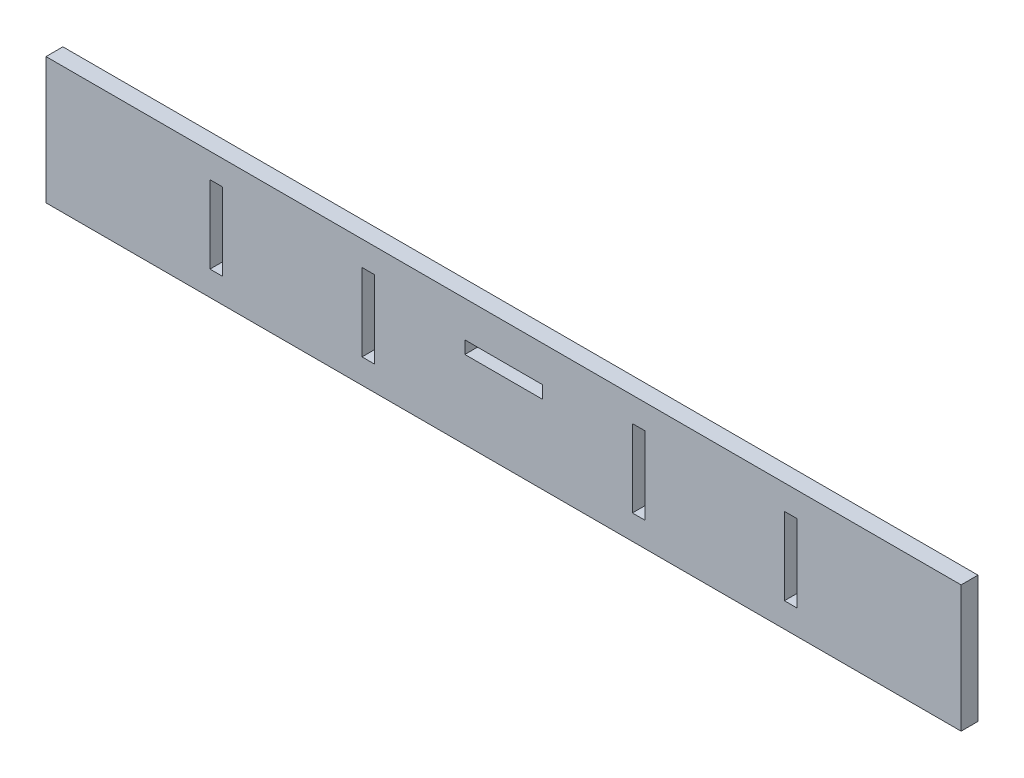
from build123d import *

# Parameters (mm, degrees)
SKETCH2_W           = 130
SKETCH2_H           = 18
BOSS_EXTRUDE1_DEPTH = 2.4
SKETCH3_W           = 1.8
SKETCH3_H           = 11
SKETCH3_H_2         = 5.5
CUT_EXTRUDE1_DEPTH  = 11


with BuildPart() as part:
    # Sketch2 → Boss-Extrude1 (new body)
    with BuildSketch(Plane.XY):
        Rectangle(SKETCH2_W, SKETCH2_H)
    extrude(amount=BOSS_EXTRUDE1_DEPTH)

    # Sketch3 → Cut-Extrude1 (cut)
    with BuildSketch(Plane.XY.offset(2.4)):
        with Locations((-40.8, 0)):
            Rectangle(SKETCH3_W, SKETCH3_H)
        with Locations((-19.2, 2.75)):
            Rectangle(SKETCH3_W, SKETCH3_H_2)
        with Locations((-19.2, -2.75)):
            Rectangle(SKETCH3_W, SKETCH3_H_2)
        with Locations((19.2, 0)):
            Rectangle(SKETCH3_W, SKETCH3_H)
        with Locations((40.8, 0)):
            Rectangle(SKETCH3_W, SKETCH3_H)
        Polygon((0, 3), (0, 3.9), (-5.5, 3.9), (-5.5, 2.1), (0, 2.1), align=None)
        Polygon((5.5, 3.9), (0, 3.9), (0, 3), (0, 2.1), (5.5, 2.1), align=None)
    extrude(amount=-CUT_EXTRUDE1_DEPTH, mode=Mode.SUBTRACT)


solid = part.part
